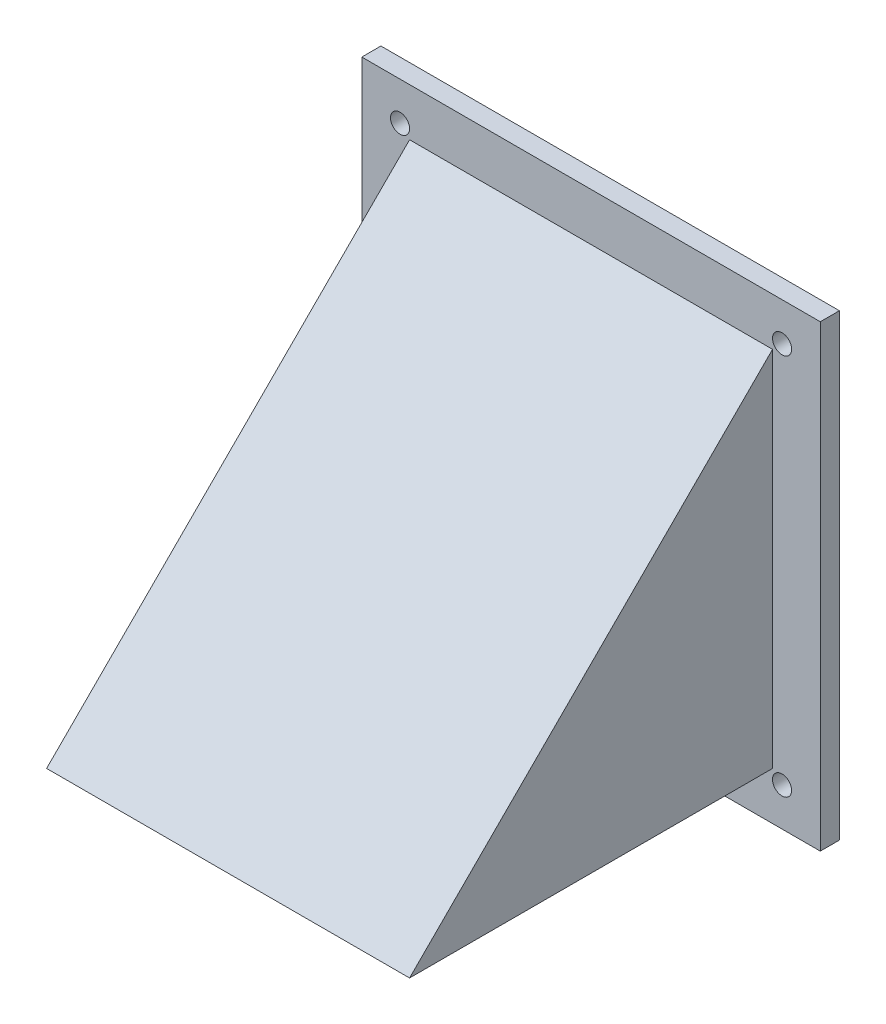
from build123d import *

# Parameters (mm, degrees)
SKETCH2_W           = 120
SKETCH2_H           = 120
SKETCH2_R           = 2.5
SKETCH2_W_2         = 87.5
SKETCH2_H_2         = 87.5
BOSS_EXTRUDE1_DEPTH = 5
SKETCH3_W           = 95
SKETCH3_H           = 95
BOSS_EXTRUDE2_DEPTH = 95
CUT_EXTRUDE1_DEPTH  = 95
CUT_EXTRUDE4_REACH  = 191.621
SKETCH5_W           = 87.5
SKETCH5_H           = 87.5
CUT_EXTRUDE5_REACH  = 196.487
SKETCH9_W           = 87.5
SKETCH9_H           = 83.964466094
CUT_EXTRUDE7_DEPTH  = 87.5


with BuildPart() as part:
    # Sketch2 → Boss-Extrude1 (new body)
    with BuildSketch(Plane.XY):
        with Locations((60, -60)):
            Rectangle(SKETCH2_W, SKETCH2_H)
        with Locations((10, -10.00000061)):
            Circle(SKETCH2_R, mode=Mode.SUBTRACT)
        with Locations((110, -10)):
            Circle(SKETCH2_R, mode=Mode.SUBTRACT)
        with Locations((9.988952602, -110)):
            Circle(SKETCH2_R, mode=Mode.SUBTRACT)
        with Locations((109.988952602, -110)):
            Circle(SKETCH2_R, mode=Mode.SUBTRACT)
        with Locations((60, -60)):
            Rectangle(SKETCH2_W_2, SKETCH2_H_2, mode=Mode.SUBTRACT)
    extrude(amount=BOSS_EXTRUDE1_DEPTH)

    # Sketch3 → Boss-Extrude2 (add)
    with BuildSketch(Plane.XY.offset(5)):
        with Locations((60, -60)):
            Rectangle(SKETCH3_W, SKETCH3_H)
    extrude(amount=BOSS_EXTRUDE2_DEPTH)

    # Sketch4 → Cut-Extrude1 (cut)
    with BuildSketch(Plane(origin=(107.5, 0, 0), x_dir=(0, 0, -1), z_dir=(1, 0, 0))):
        Polygon((-5, -12.5), (-100, -107.5), (-100, -12.5), align=None)
    extrude(amount=-CUT_EXTRUDE1_DEPTH, mode=Mode.SUBTRACT)

    # Cut-Extrude4: up to this plane
    cut_extrude4_end = Plane(origin=(12.5, -14.267766953, 3.232233047), z_dir=(0, -0.7071067811865476, -0.7071067811865476))
    # Sketch5 → Cut-Extrude4 (cut, up to the surface)
    with BuildSketch(Plane.XZ.offset(107.5), mode=Mode.PRIVATE) as cut_extrude4_sk1:
        with Locations((60, 52.5)):
            Rectangle(SKETCH5_W, SKETCH5_H)
    cut_extrude4_tool1 = split(extrude(cut_extrude4_sk1.sketch, amount=-CUT_EXTRUDE4_REACH, mode=Mode.PRIVATE), bisect_by=cut_extrude4_end, keep=Keep.BOTH, mode=Mode.PRIVATE)
    add(cut_extrude4_tool1.solids().sort_by_distance((60, -107.5, 52.5))[0], mode=Mode.SUBTRACT)

    # Cut-Extrude5: up to this plane
    cut_extrude5_end = Plane(origin=(12.5, -14.267766953, 3.232233047), z_dir=(0, -0.7071067811865476, -0.7071067811865476))
    # Sketch9 → Cut-Extrude5 (cut, up to the surface)
    with BuildSketch(Plane(origin=(0, 0, 5), x_dir=(-1, 0, 0), z_dir=(0, 0, -1)), mode=Mode.PRIVATE) as cut_extrude5_sk1:
        with Locations((-60, -61.767766953)):
            Rectangle(SKETCH9_W, SKETCH9_H)
    cut_extrude5_tool1 = split(extrude(cut_extrude5_sk1.sketch, amount=-CUT_EXTRUDE5_REACH, mode=Mode.PRIVATE), bisect_by=cut_extrude5_end, keep=Keep.BOTH, mode=Mode.PRIVATE)
    add(cut_extrude5_tool1.solids().sort_by_distance((60, -61.767767, 5))[0], mode=Mode.SUBTRACT)

    # Sketch10 → Cut-Extrude7 (cut)
    with BuildSketch(Plane.ZY.offset(-103.75)):
        Polygon((8.75, -19.785533906), (5, -19.785533906), (5, -16.25), align=None)
    extrude(amount=CUT_EXTRUDE7_DEPTH, mode=Mode.SUBTRACT)


solid = part.part
